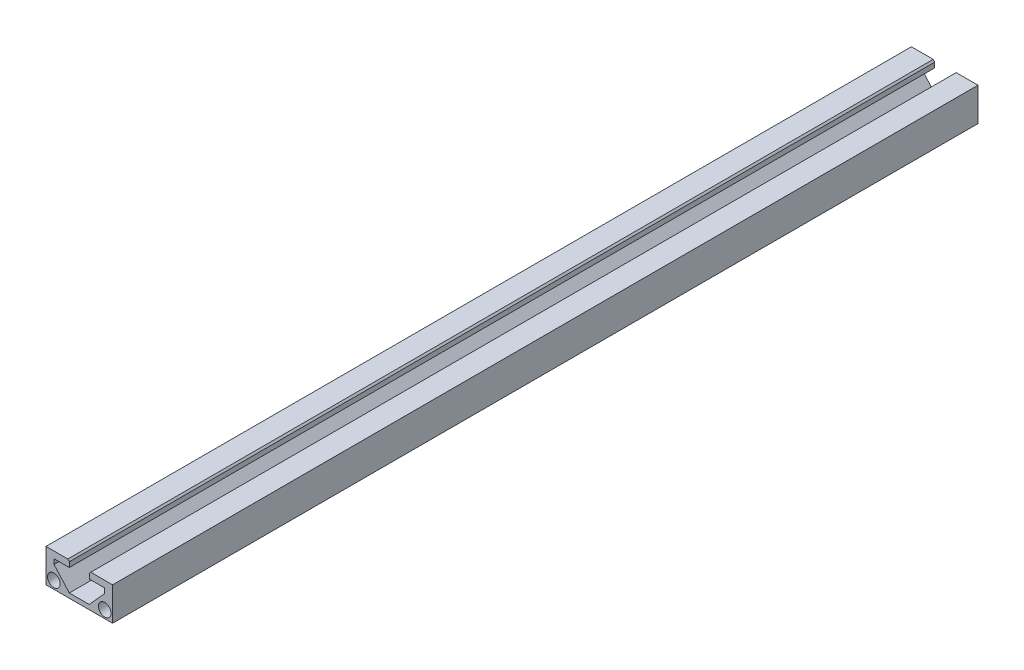
from build123d import *

# Parameters (mm, degrees)
BOSS_EXTRUDE1_DEPTH = 130
SKETCH2_R           = 1.9
CUT_EXTRUDE1_DEPTH  = 261.334886359


with BuildPart() as part:
    # Sketch1 → Boss-Extrude1 (new, symmetric)
    with BuildSketch(Plane.XY):
        Polygon((0, 0), (0, -1.382978723), (10, -1.382978723), (10, 8.617021277), (3.448211747, 8.617021277), (3, 8.117021277), (3, 6.617021277), (7.587018089, 6.617021277), (7.587018089, 5.117021277), (3, 0), align=None)
    boss_extrude1 = extrude(amount=BOSS_EXTRUDE1_DEPTH, both=True)

    # Mirror1: Boss-Extrude1 across plane
    add(boss_extrude1.mirror(Plane(origin=(0, 0, 0), x_dir=(0, 0, 1), z_dir=(1, 0, 0))))

    # Sketch2 → Cut-Extrude1 (cut, through all)
    with BuildSketch(Plane.XY.offset(130)):
        with Locations((7.646716257, 0.97030502)):
            Circle(SKETCH2_R)
    cut_extrude1 = extrude(amount=-CUT_EXTRUDE1_DEPTH, mode=Mode.SUBTRACT)

    # Mirror2: Cut-Extrude1 across plane
    add(cut_extrude1.mirror(Plane(origin=(0, 0, 0), x_dir=(0, 0, 1), z_dir=(1, 0, 0))), mode=Mode.SUBTRACT)


solid = part.part
